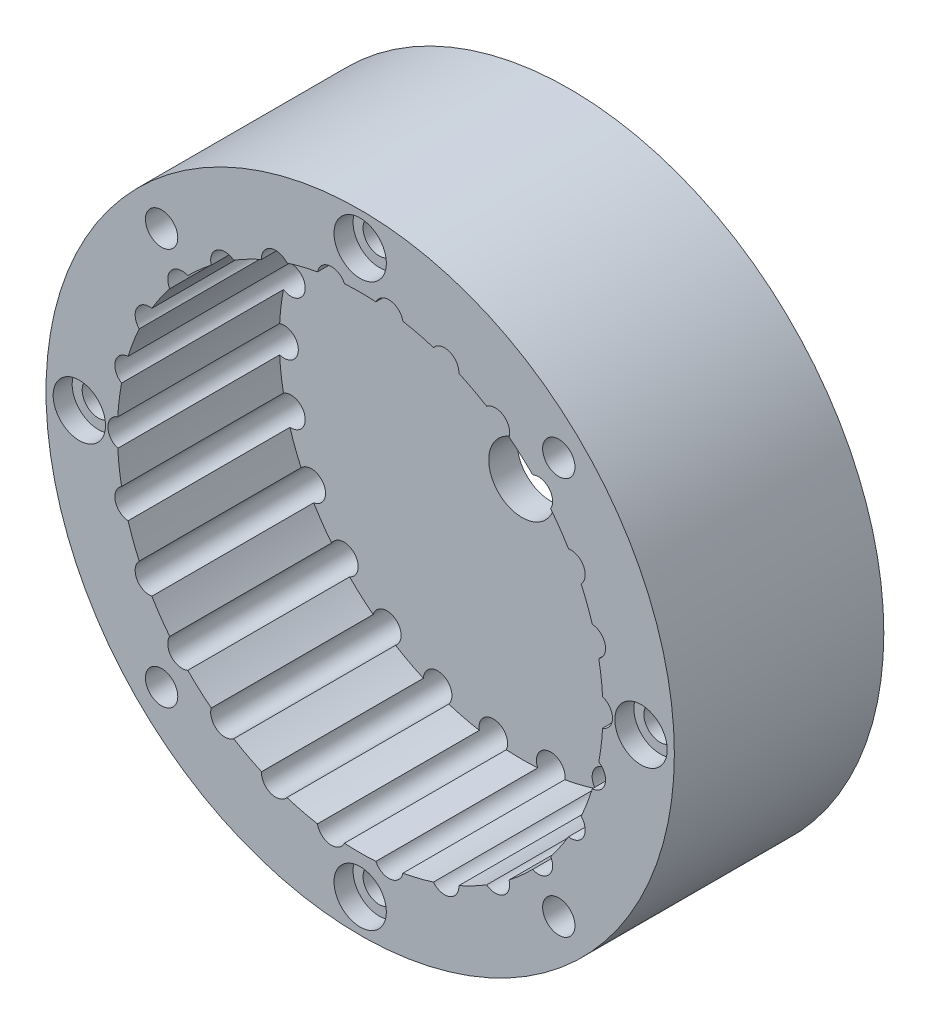
from build123d import *

# Parameters (mm, degrees)
SKETCH1_R               = 33
SKETCH1_R_2             = 25.5
BOSS_EXTRUDE2_DEPTH     = 17
BOSS_EXTRUDE3_START     = -5
SKETCH1_3_R             = 33
BOSS_EXTRUDE3_DEPTH     = 5
CUT_EXTRUDE4_DEPTH      = 50.668903753
CUT_EXTRUDE4_DEPTH_BACK = 3
SKETCH1_5_R             = 1.5
CUT_EXTRUDE6_DEPTH      = 50.668903753
CUT_EXTRUDE6_DEPTH_BACK = 50.668903753
SKETCH3_R               = 1.7
SKETCH3_R_2             = 3.5
SKETCH4_R               = 10
CUT_EXTRUDE7_DEPTH      = 2
SKETCH6_R               = 1.7
CUT_EXTRUDE8_DEPTH      = 10
SKETCH7_R               = 2.75
CUT_EXTRUDE9_DEPTH      = 2


with BuildPart() as part:
    # Sketch1 → Boss-Extrude2 (new body)
    with BuildSketch(Plane.XY):
        Circle(SKETCH1_R)
        Circle(SKETCH1_R_2, mode=Mode.SUBTRACT)
    extrude(amount=BOSS_EXTRUDE2_DEPTH)

    # Sketch1<3> → Boss-Extrude3 (add)
    with BuildSketch(Plane.XY.offset(BOSS_EXTRUDE3_START)):
        Circle(SKETCH1_3_R)
    extrude(amount=BOSS_EXTRUDE3_DEPTH)

    # Sketch1<5> → Cut-Extrude4 (cut, two sides: drawn at the far end of the back side and taken through both)
    with BuildSketch(Plane.XY.offset(-CUT_EXTRUDE4_DEPTH_BACK)):
        with Locations(Location((25, 0, 0), (0, 0, 72.141537302))):
            Circle(SKETCH1_5_R)
        with Locations(Location((24.273545436, -5.982891607, 0), (0, 0, 274.012308852))):
            Circle(SKETCH1_5_R)
        with Locations(Location((22.136400641, -11.618079301, 0), (0, 0, 260.166155006))):
            Circle(SKETCH1_5_R)
        with Locations(Location((18.712768704, -16.578066456, 0), (0, 0, 246.32000116))):
            Circle(SKETCH1_5_R)
        with Locations(Location((14.201618668, -20.574596647, 0), (0, 0, 232.473847314))):
            Circle(SKETCH1_5_R)
        with Locations(Location((8.865122176, -23.375406067, 0), (0, 0, 218.627693468))):
            Circle(SKETCH1_5_R)
        with Locations(Location((3.013417006, -24.817721852, 0), (0, 0, 204.781539621))):
            Circle(SKETCH1_5_R)
        with Locations(Location((-3.013417006, -24.817721852, 0), (0, 0, 190.935385775))):
            Circle(SKETCH1_5_R)
        with Locations(Location((-8.865122176, -23.375406067, 0), (0, 0, 177.089231929))):
            Circle(SKETCH1_5_R)
        with Locations(Location((-14.201618668, -20.574596647, 0), (0, 0, 163.243078083))):
            Circle(SKETCH1_5_R)
        with Locations(Location((-18.712768704, -16.578066456, 0), (0, 0, 149.396924237))):
            Circle(SKETCH1_5_R)
        with Locations(Location((-22.136400641, -11.618079301, 0), (0, 0, 135.550770391))):
            Circle(SKETCH1_5_R)
        with Locations(Location((-24.273545436, -5.982891607, 0), (0, 0, 121.704616545))):
            Circle(SKETCH1_5_R)
        with Locations(Location((-25, 0, 0), (0, 0, 107.858462698))):
            Circle(SKETCH1_5_R)
        with Locations(Location((-24.273545436, 5.982891607, 0), (0, 0, 238.295383455))):
            Circle(SKETCH1_5_R)
        with Locations(Location((-22.136400641, 11.618079301, 0), (0, 0, 224.449229609))):
            Circle(SKETCH1_5_R)
        with Locations(Location((-18.712768704, 16.578066456, 0), (0, 0, 210.603075763))):
            Circle(SKETCH1_5_R)
        with Locations(Location((-14.201618668, 20.574596647, 0), (0, 0, 196.756921917))):
            Circle(SKETCH1_5_R)
        with Locations(Location((-8.865122176, 23.375406067, 0), (0, 0, 182.910768071))):
            Circle(SKETCH1_5_R)
        with Locations(Location((-3.013417006, 24.817721852, 0), (0, 0, 169.064614225))):
            Circle(SKETCH1_5_R)
        with Locations(Location((3.013417006, 24.817721852, 0), (0, 0, 155.218460378))):
            Circle(SKETCH1_5_R)
        with Locations(Location((8.865122176, 23.375406067, 0), (0, 0, 141.372306532))):
            Circle(SKETCH1_5_R)
        with Locations(Location((14.201618668, 20.574596647, 0), (0, 0, 127.526152686))):
            Circle(SKETCH1_5_R)
        with Locations(Location((18.712768704, 16.578066456, 0), (0, 0, 113.67999884))):
            Circle(SKETCH1_5_R)
        with Locations(Location((22.136400641, 11.618079301, 0), (0, 0, 99.833844994))):
            Circle(SKETCH1_5_R)
        with Locations(Location((24.273545436, 5.982891607, 0), (0, 0, 85.987691148))):
            Circle(SKETCH1_5_R)
    extrude(amount=CUT_EXTRUDE4_DEPTH + CUT_EXTRUDE4_DEPTH_BACK, mode=Mode.SUBTRACT)

    # Sketch3 → Cut-Extrude6 (cut, two sides: drawn at the far end of the back side and taken through both)
    with BuildSketch(Plane.XY.offset(-CUT_EXTRUDE6_DEPTH_BACK)):
        with Locations((0, 29.5)):
            Circle(SKETCH3_R)
        with Locations((29.5, 0)):
            Circle(SKETCH3_R)
        with Locations((0, -29.5)):
            Circle(SKETCH3_R)
        with Locations((-29.5, 0)):
            Circle(SKETCH3_R)
        Circle(SKETCH3_R_2)
    extrude(amount=CUT_EXTRUDE6_DEPTH + CUT_EXTRUDE6_DEPTH_BACK, mode=Mode.SUBTRACT)

    # Sketch4 → Cut-Extrude7 (cut)
    with BuildSketch(Plane(origin=(0, 0, -5), x_dir=(-1, 0, 0), z_dir=(0, 0, -1))):
        Circle(SKETCH4_R)
    extrude(amount=-CUT_EXTRUDE7_DEPTH, mode=Mode.SUBTRACT)

    # Sketch6 → Cut-Extrude8 (cut)
    with BuildSketch(Plane.XY.offset(17)):
        with Locations((-20.859650045, 20.859650045)):
            Circle(SKETCH6_R)
        with Locations((20.859650045, 20.859650045)):
            Circle(SKETCH6_R)
        with Locations((20.859650045, -20.859650045)):
            Circle(SKETCH6_R)
        with Locations((-20.859650045, -20.859650045)):
            Circle(SKETCH6_R)
    extrude(amount=-CUT_EXTRUDE8_DEPTH, mode=Mode.SUBTRACT)

    # Sketch7 → Cut-Extrude9 (cut)
    with BuildSketch(Plane.XY.offset(17)):
        with Locations((0, 29.5)):
            Circle(SKETCH7_R)
        with Locations((29.5, 0)):
            Circle(SKETCH7_R)
        with Locations((0, -29.5)):
            Circle(SKETCH7_R)
        with Locations((-29.5, 0)):
            Circle(SKETCH7_R)
    extrude(amount=-CUT_EXTRUDE9_DEPTH, mode=Mode.SUBTRACT)


solid = part.part
